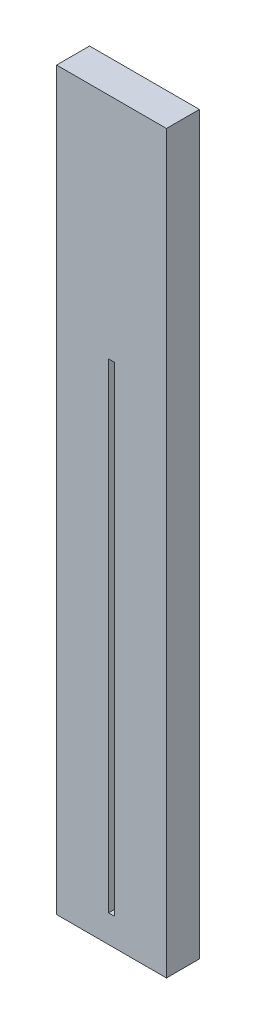
from build123d import *

# Parameters (mm, degrees)
SKETCH1_W           = 112
SKETCH1_H           = 33.6
BOSS_EXTRUDE1_DEPTH = 750
SKETCH2_W           = 6.1
SKETCH2_H           = 489.1
CUT_EXTRUDE1_DEPTH  = 10.1


with BuildPart() as part:
    # Sketch1 → Boss-Extrude1 (new body)
    with BuildSketch(Plane(origin=(0, 0, 0), x_dir=(1, 0, 0), z_dir=(0, 1, 0))):
        Rectangle(SKETCH1_W, SKETCH1_H)
    extrude(amount=BOSS_EXTRUDE1_DEPTH)

    # Sketch2 → Cut-Extrude1 (cut)
    with BuildSketch(Plane.XY.offset(16.8)):
        with Locations((0, 272.55)):
            Rectangle(SKETCH2_W, SKETCH2_H)
    extrude(amount=-CUT_EXTRUDE1_DEPTH, mode=Mode.SUBTRACT)


solid = part.part
